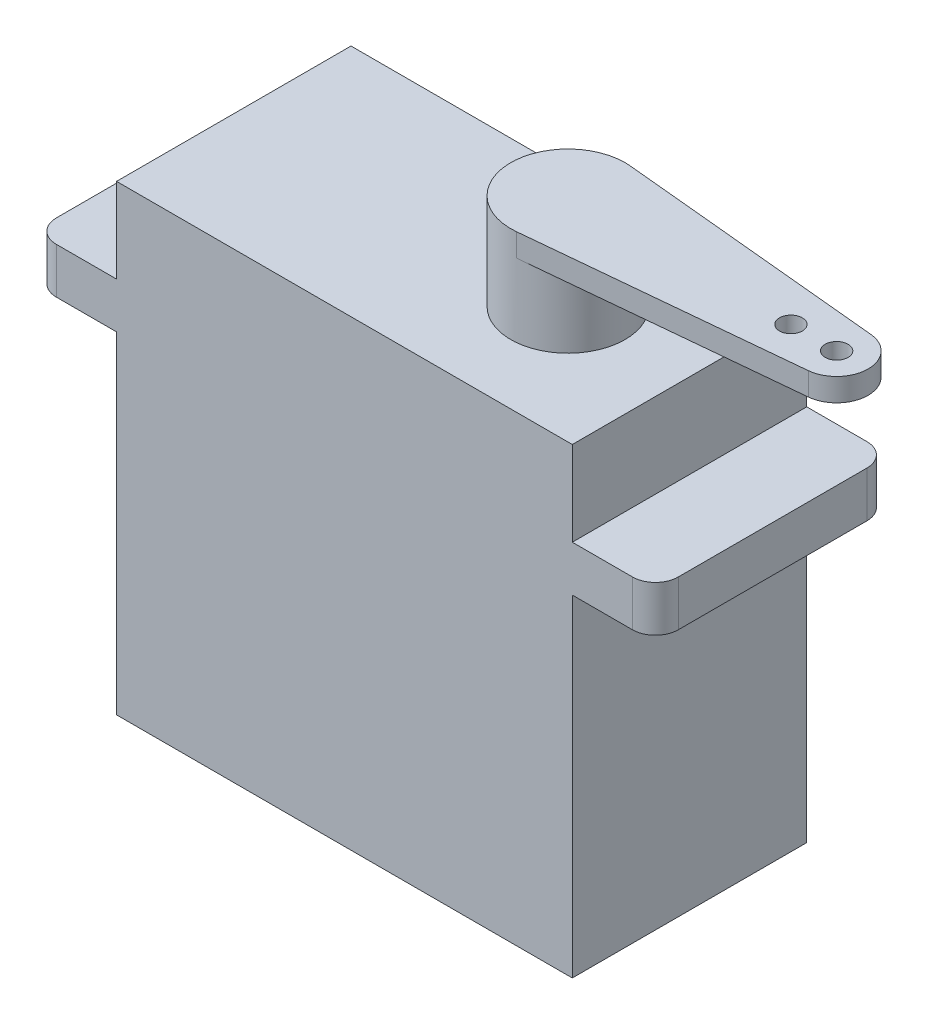
from build123d import *

# Parameters (mm, degrees)
SKETCH2_W           = 39.85
SKETCH2_H           = 20.5
BOSS_EXTRUDE1_DEPTH = 40.4
BOSS_EXTRUDE2_START = 29
SKETCH3_W           = 54.38
SKETCH3_H           = 20.5
BOSS_EXTRUDE2_DEPTH = 4
FILLET1_R           = 2
SKETCH5_R           = 5
BOSS_EXTRUDE3_DEPTH = 8.4
BOSS_EXTRUDE4_START = -2
BOSS_EXTRUDE4_DEPTH = 2
SKETCH7_R           = 1
CUT_EXTRUDE1_DEPTH  = 2


with BuildPart() as part:
    # Sketch2 → Boss-Extrude1 (new body)
    with BuildSketch(Plane(origin=(0, 0, 0), x_dir=(1, 0, 0), z_dir=(0, 1, 0))):
        with Locations((19.925, 10.25)):
            Rectangle(SKETCH2_W, SKETCH2_H)
    extrude(amount=BOSS_EXTRUDE1_DEPTH)

    # Sketch3 → Boss-Extrude2 (add)
    with BuildSketch(Plane(origin=(0, 0, 0), x_dir=(1, 0, 0), z_dir=(0, 1, 0)).offset(BOSS_EXTRUDE2_START)):
        with Locations((19.925, 10.25)):
            Rectangle(SKETCH3_W, SKETCH3_H)
    extrude(amount=BOSS_EXTRUDE2_DEPTH)

    # Fillet1
    fillet1_edges = [part.edges().sort_by_distance(p)[0] for p in [
        (-7.265, 31, 0),
        (47.115, 31, -20.5),
        (-7.265, 31, -20.5),
        (47.115, 31, 0),
    ]]
    fillet(fillet1_edges, radius=FILLET1_R)

    # Sketch5 → Boss-Extrude3 (add)
    with BuildSketch(Plane(origin=(0, 40.4, 0), x_dir=(1, 0, 0), z_dir=(0, 1, 0))):
        with Locations(Location((29.215, 10.25, 0), (0, 0, 90))):
            Circle(SKETCH5_R)
    extrude(amount=BOSS_EXTRUDE3_DEPTH)

    # Sketch6 → Boss-Extrude4 (add)
    with BuildSketch(Plane(origin=(0, 48.8, 0), x_dir=(1, 0, 0), z_dir=(0, 1, 0)).offset(BOSS_EXTRUDE4_START)):
        with BuildLine():
            Line((29.693723404, 15.227029626), (52.978297872, 12.987366295))
            ThreePointArc((52.978297872, 12.987366295), (55.465, 10.25), (52.978297872, 7.512633705))
            Line((52.978297872, 7.512633705), (29.693723404, 5.272970374))
            ThreePointArc((29.693723404, 5.272970374), (24.215, 10.25), (29.693723404, 15.227029626))
        make_face()
    extrude(amount=BOSS_EXTRUDE4_DEPTH)

    # Sketch7 → Cut-Extrude1 (cut)
    with BuildSketch(Plane(origin=(0, 48.8, 0), x_dir=(1, 0, 0), z_dir=(0, 1, 0))):
        with Locations(Location((52.715, 10.25, 0), (0, 0, 270))):
            Circle(SKETCH7_R)
        with Locations(Location((48.715, 10.25, 0), (0, 0, 270))):
            Circle(SKETCH7_R)
    extrude(amount=-CUT_EXTRUDE1_DEPTH, mode=Mode.SUBTRACT)


solid = part.part
